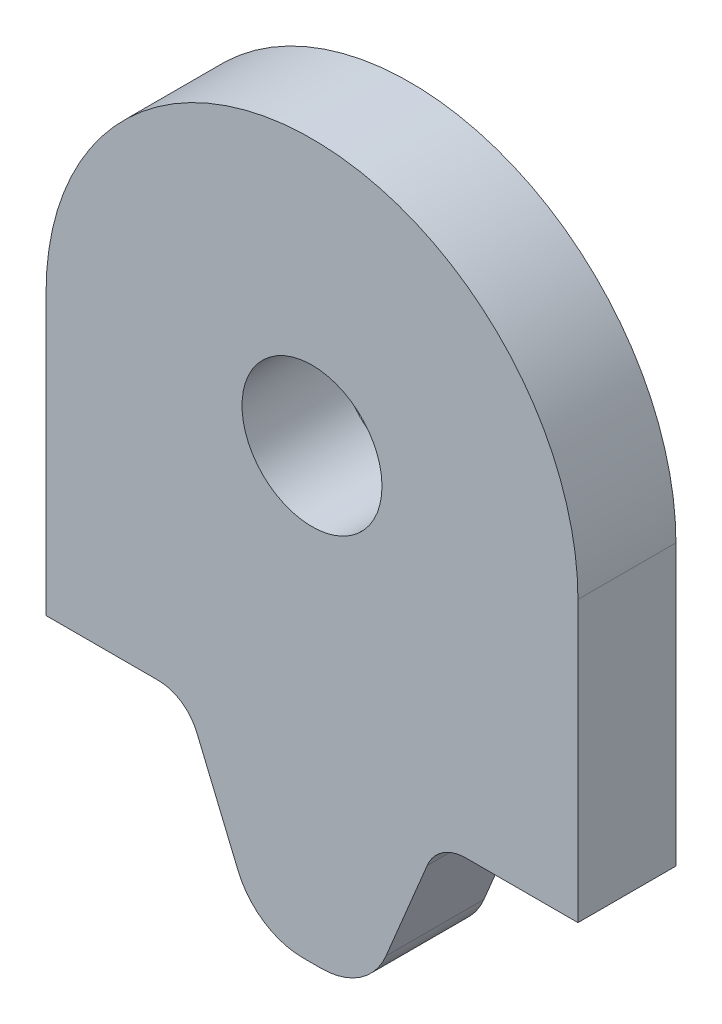
from build123d import *

# Parameters (mm, degrees)
SKETCH1_R           = 2.5
SKETCH1_R_2         = 1.5
BOSS_EXTRUDE1_DEPTH = 7
SKETCH2_R           = 5
CUT_EXTRUDE1_DEPTH  = 50.345719166
FILLET1_R           = 5
FILLET2_R           = 3


with BuildPart() as part:
    # Sketch1 → Boss-Extrude1 (new body)
    with BuildSketch(Plane.XY):
        with BuildLine():
            Line((-19, 0), (-19, -32))
            Line((-19, -32), (-14.8, -32))
            Line((-14.8, -32), (-14.8, -45))
            Line((-14.8, -45), (-5, -45))
            Line((-5, -45), (-5, -42))
            Line((-5, -42), (5, -42))
            Line((5, -42), (5, -45))
            Line((5, -45), (19, -45))
            Line((19, -45), (19, 0))
            ThreePointArc((19, 0), (0, 19), (-19, 0))
        make_face()
        Circle(SKETCH1_R, mode=Mode.SUBTRACT)
        with Locations((-14, -27)):
            Circle(SKETCH1_R_2, mode=Mode.SUBTRACT)
        with Locations(Location((14, -27, 0), (0, 0, 180))):
            Circle(SKETCH1_R_2, mode=Mode.SUBTRACT)
    extrude(amount=BOSS_EXTRUDE1_DEPTH)

    # Sketch2 → Cut-Extrude1 (cut, through all)
    with BuildSketch(Plane.XY.offset(7)):
        Circle(SKETCH2_R)
        Polygon((-19, -20), (-9, -20), (-4, -32), (4, -32), (9, -20), (19, -20), (19, -45), (-19, -45), align=None)
    extrude(amount=-CUT_EXTRUDE1_DEPTH, mode=Mode.SUBTRACT)

    # Fillet1
    fillet1_edges = [part.edges().sort_by_distance(p)[0] for p in [
        (-4, -32, 3.5),
        (4, -32, 3.5),
    ]]
    fillet(fillet1_edges, radius=FILLET1_R)

    # Fillet2
    fillet2_edges = [part.edges().sort_by_distance(p)[0] for p in [
        (-9, -20, 3.5),
        (9, -20, 3.5),
    ]]
    fillet(fillet2_edges, radius=FILLET2_R)


solid = part.part
